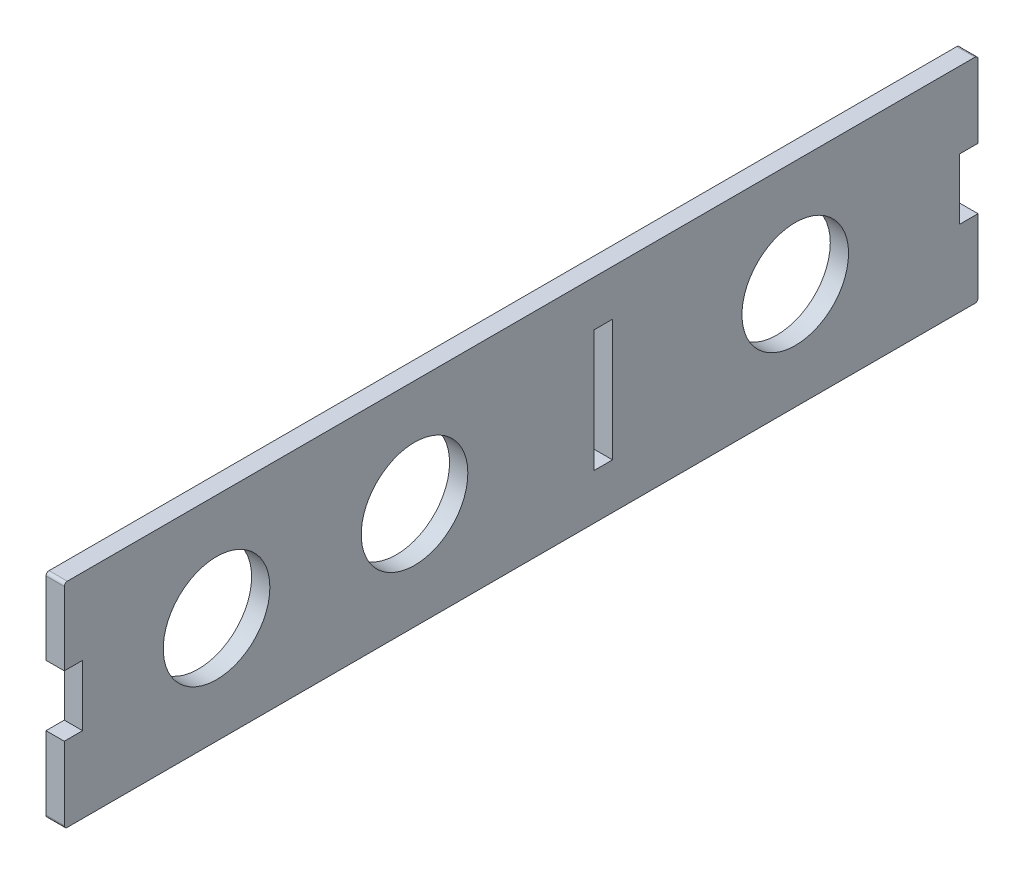
from build123d import *

# Parameters (mm, degrees)
SKETCH1_W   = 300
SKETCH1_H   = 70
WALL_DEPTH  = 6
SKETCH2_W   = 6
SKETCH2_H   = 40
SKETCH2_H_2 = 20
MOUNT_DEPTH = 309.116860947
SKETCH3_R   = 17.5
LITE_DEPTH  = 309.116860947
FILLET_2_R  = 1


with BuildPart() as part:
    # Sketch1 → wall (new body)
    with BuildSketch(Plane(origin=(0, 0, 0), x_dir=(0, 0, -1), z_dir=(1, 0, 0))):
        with Locations((150, 35)):
            Rectangle(SKETCH1_W, SKETCH1_H)
    extrude(amount=WALL_DEPTH)

    # Sketch2 → mount (cut, through all)
    with BuildSketch(Plane(origin=(6, 0, 0), x_dir=(0, 0, -1), z_dir=(1, 0, 0))):
        with Locations((177, 35)):
            Rectangle(SKETCH2_W, SKETCH2_H)
        with Locations((297, 35)):
            Rectangle(SKETCH2_W, SKETCH2_H_2)
        with Locations((3, 35)):
            Rectangle(SKETCH2_W, SKETCH2_H_2)
    extrude(amount=-MOUNT_DEPTH, mode=Mode.SUBTRACT)

    # Sketch3 → lite (cut, through all)
    with BuildSketch(Plane(origin=(6, 0, 0), x_dir=(0, 0, -1), z_dir=(1, 0, 0))):
        with Locations((50, 35)):
            Circle(SKETCH3_R)
        with Locations((115, 35)):
            Circle(SKETCH3_R)
        with Locations((240, 35)):
            Circle(SKETCH3_R)
    extrude(amount=-LITE_DEPTH, mode=Mode.SUBTRACT)

    # fillet 2
    fillet_2_edges = [part.edges().sort_by_distance(p)[0] for p in [
        (3, 70, 0),
        (3, 70, -300),
        (3, 0, -300),
        (3, 0, 0),
    ]]
    fillet(fillet_2_edges, radius=FILLET_2_R)


solid = part.part
